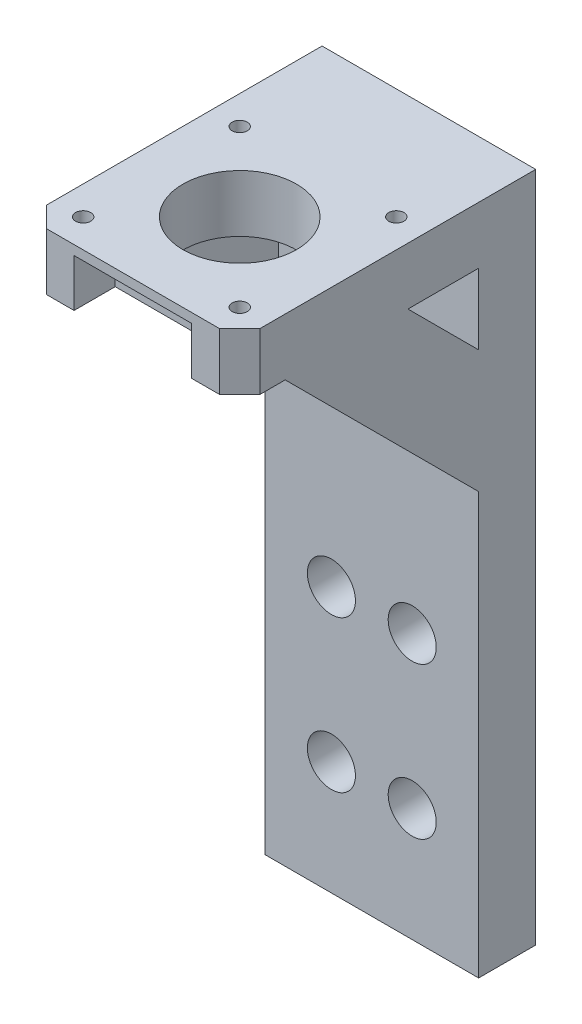
from build123d import *

# Parameters (mm, degrees)
SKETCH1_R           = 11.25
SKETCH1_R_2         = 1.5
BOSS_EXTRUDE1_DEPTH = 11.3
SKETCH4_W           = 34.3
SKETCH4_H           = 11.3
BOSS_EXTRUDE3_DEPTH = 5
BOSS_EXTRUDE4_DEPTH = 11.3
SKETCH6_W           = 34.3
SKETCH6_H           = 133
BOSS_EXTRUDE5_DEPTH = 11.3
BOSS_EXTRUDE6_DEPTH = 133
CUT_EXTRUDE1_DEPTH  = 121.7
BOSS_EXTRUDE8_DEPTH = 2.65
BOSS_EXTRUDE9_DEPTH = 2.65
SKETCH13_R          = 4.7625
CUT_EXTRUDE2_DEPTH  = 137.719320142
SKETCH14_W          = 23.3
SKETCH14_H          = 8.15
CUT_EXTRUDE3_DEPTH  = 9.43
CUT_EXTRUDE4_DEPTH  = 2.65


with BuildPart() as part:
    # Sketch1 → Boss-Extrude1 (new body)
    with BuildSketch(Plane(origin=(0, 0, 0), x_dir=(1, 0, 0), z_dir=(0, 1, 0))):
        Polygon((-21.15, 17.15), (-17.15, 21.15), (17.15, 21.15), (21.15, 17.15), (21.15, -17.15), (17.15, -21.15), (-17.15, -21.15), (-21.15, -17.15), align=None)
        with Locations(Location((0, 0, 0), (0, 0, 270))):
            Circle(SKETCH1_R, mode=Mode.SUBTRACT)
        with Locations(Location((-15.5, 15.5, 0), (0, 0, 270))):
            Circle(SKETCH1_R_2, mode=Mode.SUBTRACT)
        with Locations(Location((15.5, 15.5, 0), (0, 0, 270))):
            Circle(SKETCH1_R_2, mode=Mode.SUBTRACT)
        with Locations(Location((15.5, -15.5, 0), (0, 0, 270))):
            Circle(SKETCH1_R_2, mode=Mode.SUBTRACT)
        with Locations(Location((-15.5, -15.5, 0), (0, 0, 270))):
            Circle(SKETCH1_R_2, mode=Mode.SUBTRACT)
    extrude(amount=BOSS_EXTRUDE1_DEPTH)

    # Sketch4 → Boss-Extrude3 (add)
    with BuildSketch(Plane(origin=(0, 0, -21.15), x_dir=(-1, 0, 0), z_dir=(0, 0, -1))):
        with Locations((0, 5.65)):
            Rectangle(SKETCH4_W, SKETCH4_H)
    extrude(amount=BOSS_EXTRUDE3_DEPTH)

    # Sketch5 → Boss-Extrude4 (add)
    with BuildSketch(Plane(origin=(0, 11.3, 0), x_dir=(1, 0, 0), z_dir=(0, 1, 0))):
        Polygon((21.15, 17.15), (17.15, 26.15), (17.15, 21.15), align=None)
        Polygon((-17.15, 26.15), (-21.15, 17.15), (-17.15, 21.15), align=None)
    extrude(amount=-BOSS_EXTRUDE4_DEPTH)

    # Sketch6 → Boss-Extrude5 (add)
    with BuildSketch(Plane(origin=(0, 0, -26.15), x_dir=(-1, 0, 0), z_dir=(0, 0, -1))):
        with Locations((0, -55.2)):
            Rectangle(SKETCH6_W, SKETCH6_H)
    extrude(amount=BOSS_EXTRUDE5_DEPTH)

    # Sketch9 → Boss-Extrude6 (add)
    with BuildSketch(Plane(origin=(0, 11.3, 0), x_dir=(1, 0, 0), z_dir=(0, 1, 0))):
        Polygon((21.15, 17.15), (21.15, 37.45), (17.15, 37.45), (17.15, 26.15), align=None)
        Polygon((-17.15, 37.45), (-17.15, 26.15), (-21.15, 17.15), (-21.15, 37.45), align=None)
    extrude(amount=-BOSS_EXTRUDE6_DEPTH)

    # Sketch10 → Cut-Extrude1 (cut)
    with BuildSketch(Plane.XZ.offset(121.7)):
        Polygon((-17.15, -26.15), (-21.15, -17.15), (-21.15, -26.15), align=None)
        Polygon((17.15, -26.15), (21.15, -17.15), (21.15, -26.15), align=None)
    extrude(amount=-CUT_EXTRUDE1_DEPTH, mode=Mode.SUBTRACT)

    # Sketch11 → Boss-Extrude8 (add)
    with BuildSketch(Plane.ZY.offset(18.5)):
        Polygon((-26.15, -38.3), (12.15, 0), (-12.15, 0), (-26.15, -14), align=None)
    extrude(amount=BOSS_EXTRUDE8_DEPTH)

    # Sketch12 → Boss-Extrude9 (add)
    with BuildSketch(Plane(origin=(21.15, 0, 0), x_dir=(0, 0, -1), z_dir=(1, 0, 0))):
        Polygon((-12.15, 0), (12.15, 0), (26.15, -14), (26.15, -38.3), align=None)
    extrude(amount=-BOSS_EXTRUDE9_DEPTH)

    # Sketch13 → Cut-Extrude2 (cut, through all)
    with BuildSketch(Plane(origin=(0, 0, -37.45), x_dir=(-1, 0, 0), z_dir=(0, 0, -1))):
        with Locations((8, -69.2)):
            Circle(SKETCH13_R)
        with Locations((-8, -69.2)):
            Circle(SKETCH13_R)
        with Locations((8, -99.2)):
            Circle(SKETCH13_R)
        with Locations((-8, -99.2)):
            Circle(SKETCH13_R)
    extrude(amount=-CUT_EXTRUDE2_DEPTH, mode=Mode.SUBTRACT)

    # Sketch14 → Cut-Extrude3 (cut)
    with BuildSketch(Plane.XZ):
        with Locations((0, 17.075)):
            Rectangle(SKETCH14_W, SKETCH14_H)
    extrude(amount=-CUT_EXTRUDE3_DEPTH, mode=Mode.SUBTRACT)

    # Sketch15 → Cut-Extrude4 (cut)
    with BuildSketch(Plane.ZY.offset(21.15)):
        Polygon((-22.8566684, -35.0066684), (-22.8566684, -24.211458174), (-12.061458174, -24.211458174), align=None)
    extrude(amount=-CUT_EXTRUDE4_DEPTH, mode=Mode.SUBTRACT)


solid = part.part
